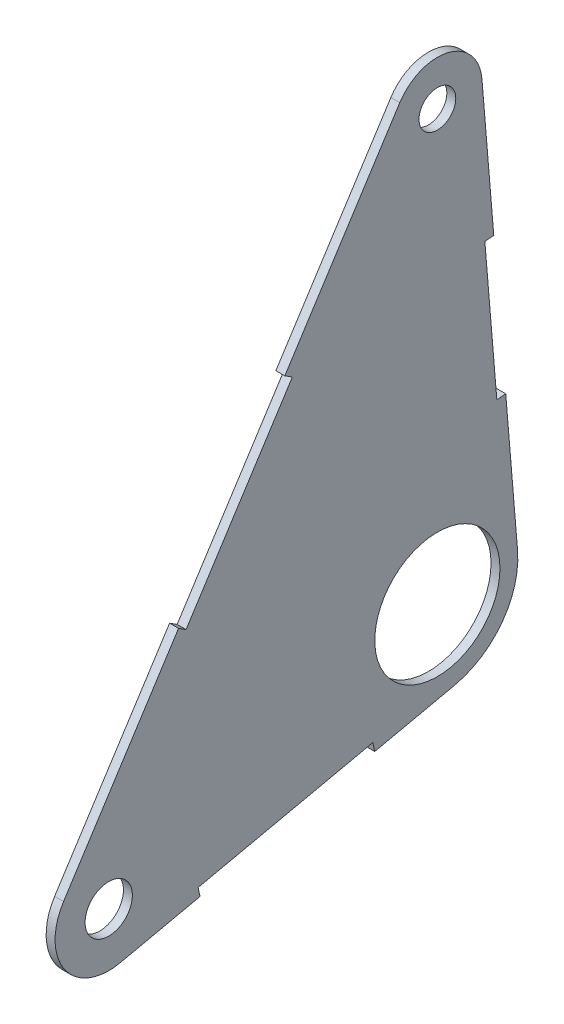
from build123d import *

# Parameters (mm, degrees)
SKETCH1_R               = 11.1125
BOSS_EXTRUDE1_DEPTH     = 1.5875
F_1_4_CLEARANCE_HOLE1_D = 6.5278
M8_CLEARANCE_HOLE1_D    = 8.4


with BuildPart() as part:
    # Sketch1 → Boss-Extrude1 (new body)
    with BuildSketch(Plane(origin=(0, 0, 0), x_dir=(0, 0, -1), z_dir=(1, 0, 0))):
        with BuildLine():
            ThreePointArc((-66.368901101, -12.489303685), (-66.173253482, -23.073465422), (-56.318740763, -26.940161264))
            Line((-56.318740763, -26.940161264), (-42.141879325, -23.840144889))
            Line((-42.141879325, -23.840144889), (-42.481000758, -22.28928935))
            Line((-42.481000758, -22.28928935), (-11.463889973, -15.506860689))
            Line((-11.463889973, -15.506860689), (-11.12476854, -17.057716228))
            Line((-11.12476854, -17.057716228), (3.052092897, -13.957699853))
            ThreePointArc((3.052092897, -13.957699853), (11.493610044, -8.487024473), (14.237804197, 1.190625))
            Line((14.237804197, 1.190625), (12.135875062, 26.326041667))
            Line((12.135875062, 26.326041667), (10.553896818, 26.19375))
            Line((10.553896818, 26.19375), (8.429842112, 51.59375))
            Line((8.429842112, 51.59375), (10.011820356, 51.726041667))
            Line((10.011820356, 51.726041667), (7.909891221, 76.861458333))
            ThreePointArc((7.909891221, 76.861458333), (1.914833772, 83.903071977), (-6.67952645, 80.488103619))
            Line((-6.67952645, 80.488103619), (-27.090385813, 48.694358158))
            Line((-27.090385813, 48.694358158), (-25.754480523, 47.836737434))
            Line((-25.754480523, 47.836737434), (-44.622136448, 18.446821053))
            Line((-44.622136448, 18.446821053), (-45.958041738, 19.304441777))
            Line((-45.958041738, 19.304441777), (-66.368901101, -12.489303685))
        make_face()
        Circle(SKETCH1_R, mode=Mode.SUBTRACT)
    extrude(amount=BOSS_EXTRUDE1_DEPTH)

    # 1/4 Clearance Hole1 (through all)
    with Locations(Plane(origin=(1.5875, 0, 0), x_dir=(0, 0, -1), z_dir=(1, 0, 0))):
        with Locations((0, 76.2)):
            Hole(F_1_4_CLEARANCE_HOLE1_D / 2)

    # M8 Clearance Hole1 (through all)
    with Locations(Plane(origin=(1.5875, 0, 0), x_dir=(0, 0, -1), z_dir=(1, 0, 0))):
        with Locations((-58.353469361, -17.635028028)):
            Hole(M8_CLEARANCE_HOLE1_D / 2)


solid = part.part
